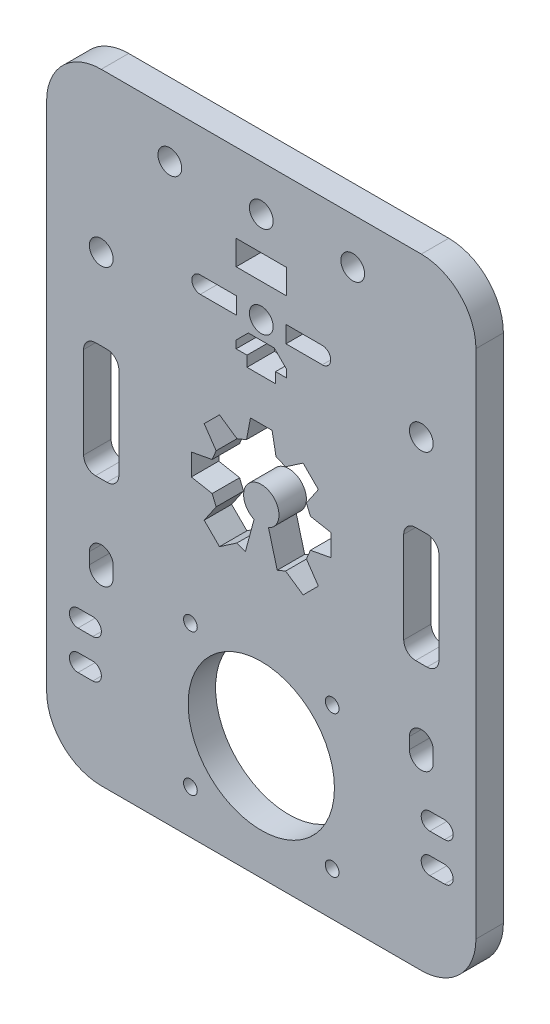
from build123d import *

# Parameters (mm, degrees)
CROQUIS1_R              = 1.5
CROQUIS1_R_2            = 16
CROQUIS1_R_3            = 2.6
CROQUIS1_W              = 11
CROQUIS1_H              = 5.4
SALIENTE_EXTRUIR1_DEPTH = 6


with BuildPart() as part:
    # Croquis1 → Saliente-Extruir1 (new body)
    with BuildSketch(Plane.XY):
        with BuildLine():
            Line((240.259705315, 349.798608336), (310.25970522, 349.798608336))
            ThreePointArc((310.25970522, 349.798608336), (318.706095722, 346.299998838), (322.204705221, 337.853608336))
            Line((322.204705221, 337.853608336), (322.20470522, 226.043602373))
            ThreePointArc((322.20470522, 226.043602373), (318.706095721, 217.597211872), (310.25970522, 214.098602373))
            Line((310.25970522, 214.098602373), (240.259705314, 214.098602373))
            ThreePointArc((240.259705314, 214.098602373), (231.813314813, 217.597211873), (228.314705315, 226.043602374))
            Line((228.314705315, 226.043602374), (228.314705315, 337.853608336))
            ThreePointArc((228.314705315, 337.853608336), (231.813314814, 346.299998837), (240.259705315, 349.798608336))
        make_face()
        with Locations((259.759705267, 223.648603564)):
            Circle(CROQUIS1_R, mode=Mode.SUBTRACT)
        with Locations((290.759705267, 223.648603373)):
            Circle(CROQUIS1_R, mode=Mode.SUBTRACT)
        with Locations((290.759705459, 254.648603373)):
            Circle(CROQUIS1_R, mode=Mode.SUBTRACT)
        with Locations((259.759705459, 254.648603564)):
            Circle(CROQUIS1_R, mode=Mode.SUBTRACT)
        with Locations((275.259705363, 239.148602396)):
            Circle(CROQUIS1_R_2, mode=Mode.SUBTRACT)
        with Locations((310.25970522, 315.148608341)):
            Circle(CROQUIS1_R_3, mode=Mode.SUBTRACT)
        with Locations((240.259705315, 315.148608341)):
            Circle(CROQUIS1_R_3, mode=Mode.SUBTRACT)
        with Locations((275.259705268, 319.839051264)):
            Circle(CROQUIS1_R_3, mode=Mode.SUBTRACT)
        with Locations((295.259705059, 339.839051264)):
            Circle(CROQUIS1_R_3, mode=Mode.SUBTRACT)
        with Locations((275.259705268, 339.839051072)):
            Circle(CROQUIS1_R_3, mode=Mode.SUBTRACT)
        with Locations((255.259705059, 339.839051264)):
            Circle(CROQUIS1_R_3, mode=Mode.SUBTRACT)
        with BuildLine():
            Line((312.85970522, 254.648608341), (312.85970522, 257.148608341))
            ThreePointArc((312.85970522, 257.148608341), (310.25970522, 259.748608341), (307.65970522, 257.148608341))
            Line((307.65970522, 257.148608341), (307.65970522, 254.648608341))
            ThreePointArc((307.65970522, 254.648608341), (310.25970522, 252.048608341), (312.85970522, 254.648608341))
        make_face(mode=Mode.SUBTRACT)
        with BuildLine():
            Line((312.119953493, 241.436102396), (315.334279571, 241.436102396))
            ThreePointArc((315.334279571, 241.436102396), (317.221779571, 243.323602396), (315.334279571, 245.211102396))
            Line((315.334279571, 245.211102396), (312.119953493, 245.211102396))
            ThreePointArc((312.119953493, 245.211102396), (310.232453493, 243.323602396), (312.119953493, 241.436102396))
        make_face(mode=Mode.SUBTRACT)
        with BuildLine():
            Line((315.334279571, 233.011268799), (312.119953493, 233.011268799))
            ThreePointArc((312.119953493, 233.011268799), (310.232453493, 234.898768799), (312.119953493, 236.786268799))
            Line((312.119953493, 236.786268799), (315.334279571, 236.786268799))
            ThreePointArc((315.334279571, 236.786268799), (317.221779571, 234.898768799), (315.334279571, 233.011268799))
        make_face(mode=Mode.SUBTRACT)
        with BuildLine():
            Line((238.399457042, 233.011268799), (235.185130964, 233.011268799))
            ThreePointArc((235.185130964, 233.011268799), (233.297630964, 234.898768799), (235.185130964, 236.786268799))
            Line((235.185130964, 236.786268799), (238.399457042, 236.786268799))
            ThreePointArc((238.399457042, 236.786268799), (240.286957042, 234.898768799), (238.399457042, 233.011268799))
        make_face(mode=Mode.SUBTRACT)
        with BuildLine():
            Line((238.399457042, 241.436102396), (235.185130964, 241.436102396))
            ThreePointArc((235.185130964, 241.436102396), (233.297630964, 243.323602396), (235.185130964, 245.211102396))
            Line((235.185130964, 245.211102396), (238.399457042, 245.211102396))
            ThreePointArc((238.399457042, 245.211102396), (240.286957042, 243.323602396), (238.399457042, 241.436102396))
        make_face(mode=Mode.SUBTRACT)
        with BuildLine():
            Line((237.659705315, 254.648608341), (237.659705315, 257.148608341))
            ThreePointArc((237.659705315, 257.148608341), (240.259705315, 259.748608341), (242.859705315, 257.148608341))
            Line((242.859705315, 257.148608341), (242.859705315, 254.648608341))
            ThreePointArc((242.859705315, 254.648608341), (240.259705315, 252.048608341), (237.659705315, 254.648608341))
        make_face(mode=Mode.SUBTRACT)
        with BuildLine():
            Line((264.517482129, 281.575286085), (259.966113425, 282.436756346))
            Line((259.966113425, 282.436756346), (259.966113425, 287.16046109))
            Line((259.966113425, 287.16046109), (264.517482129, 288.021931352))
            Line((264.517482129, 288.021931352), (265.38457315, 290.115274253))
            Line((265.38457315, 290.115274253), (262.775420938, 293.942729391))
            Line((262.775420938, 293.942729391), (266.115584595, 297.282893048))
            Line((266.115584595, 297.282893048), (269.943039733, 294.673740836))
            Line((269.943039733, 294.673740836), (272.036382634, 295.540831857))
            Line((272.036382634, 295.540831857), (272.897852896, 300.092200561))
            Line((272.897852896, 300.092200561), (277.621557639, 300.092200561))
            Line((277.621557639, 300.092200561), (278.483027901, 295.540831857))
            Line((278.483027901, 295.540831857), (280.576370802, 294.673740836))
            Line((280.576370802, 294.673740836), (284.40382594, 297.282893048))
            Line((284.40382594, 297.282893048), (287.743989597, 293.942729391))
            Line((287.743989597, 293.942729391), (285.134837385, 290.115274253))
            Line((285.134837385, 290.115274253), (286.001928406, 288.021931352))
            Line((286.001928406, 288.021931352), (290.55329711, 287.16046109))
            Line((290.55329711, 287.16046109), (290.55329711, 282.436756346))
            Line((290.55329711, 282.436756346), (286.001928406, 281.575286085))
            Line((286.001928406, 281.575286085), (285.134837385, 279.481943184))
            Line((285.134837385, 279.481943184), (287.743989597, 275.654488046))
            Line((287.743989597, 275.654488046), (284.40382594, 272.314324389))
            Line((284.40382594, 272.314324389), (280.576370802, 274.923476601))
            Line((280.576370802, 274.923476601), (278.743688474, 274.164354725))
            Line((278.743688474, 274.164354725), (276.840273676, 281.267995461))
            ThreePointArc((276.840273676, 281.267995461), (275.259705267, 288.66686756), (273.679136859, 281.267995461))
            Line((273.679136859, 281.267995461), (271.775722061, 274.164354725))
            Line((271.775722061, 274.164354725), (269.943039733, 274.923476601))
            Line((269.943039733, 274.923476601), (266.115584595, 272.314324389))
            Line((266.115584595, 272.314324389), (262.775420938, 275.654488046))
            Line((262.775420938, 275.654488046), (265.38457315, 279.481943184))
            Line((265.38457315, 279.481943184), (264.517482129, 281.575286085))
        make_face(mode=Mode.SUBTRACT)
        with BuildLine():
            Line((244.109705315, 274.798608718), (244.109705315, 294.798608718))
            ThreePointArc((244.109705315, 294.798608718), (243.348182946, 296.63708635), (241.509705315, 297.398608718))
            Line((241.509705315, 297.398608718), (239.009705315, 297.398608718))
            ThreePointArc((239.009705315, 297.398608718), (237.171227684, 296.63708635), (236.409705315, 294.798608718))
            Line((236.409705315, 294.798608718), (236.409705315, 274.798608718))
            ThreePointArc((236.409705315, 274.798608718), (237.171227684, 272.960131087), (239.009705315, 272.198608718))
            Line((239.009705315, 272.198608718), (241.509705315, 272.198608718))
            ThreePointArc((241.509705315, 272.198608718), (243.348182946, 272.960131087), (244.109705315, 274.798608718))
        make_face(mode=Mode.SUBTRACT)
        with BuildLine():
            Line((314.10970522, 294.798608718), (314.10970522, 274.798608718))
            ThreePointArc((314.10970522, 274.798608718), (313.348182851, 272.960131087), (311.50970522, 272.198608718))
            Line((311.50970522, 272.198608718), (309.00970522, 272.198608718))
            ThreePointArc((309.00970522, 272.198608718), (307.171227589, 272.960131087), (306.40970522, 274.798608718))
            Line((306.40970522, 274.798608718), (306.40970522, 294.798608718))
            ThreePointArc((306.40970522, 294.798608718), (307.171227589, 296.63708635), (309.00970522, 297.398608718))
            Line((309.00970522, 297.398608718), (311.50970522, 297.398608718))
            ThreePointArc((311.50970522, 297.398608718), (313.348182851, 296.63708635), (314.10970522, 294.798608718))
        make_face(mode=Mode.SUBTRACT)
        Polygon((272.134705268, 309.294051072), (278.384705268, 309.294051072), (278.38470522, 311.598608336), (280.75970522, 311.598608336), (280.759705268, 313.278390901), (278.099045096, 315.939051072), (272.420365439, 315.939051072), (269.759705268, 313.278390901), (269.75970522, 311.598608336), (272.13470522, 311.598608336), align=None, mode=Mode.SUBTRACT)
        with BuildLine():
            Line((269.859705268, 318.001551072), (261.919333168, 318.001551072))
            ThreePointArc((261.919333168, 318.001551072), (260.081833168, 319.839051072), (261.919333168, 321.676551072))
            Line((261.919333168, 321.676551072), (269.859705268, 321.676551072))
            Line((269.859705268, 321.676551072), (269.859705268, 318.001551072))
        make_face(mode=Mode.SUBTRACT)
        with BuildLine():
            Line((288.600077367, 321.676551072), (280.659705268, 321.676551072))
            Line((280.659705268, 321.676551072), (280.659705268, 318.001551072))
            Line((280.659705268, 318.001551072), (288.600077367, 318.001551072))
            ThreePointArc((288.600077367, 318.001551072), (290.437577367, 319.839051072), (288.600077367, 321.676551072))
        make_face(mode=Mode.SUBTRACT)
        with Locations((275.259705268, 329.839051072)):
            Rectangle(CROQUIS1_W, CROQUIS1_H, mode=Mode.SUBTRACT)
    extrude(amount=SALIENTE_EXTRUIR1_DEPTH)


solid = part.part
